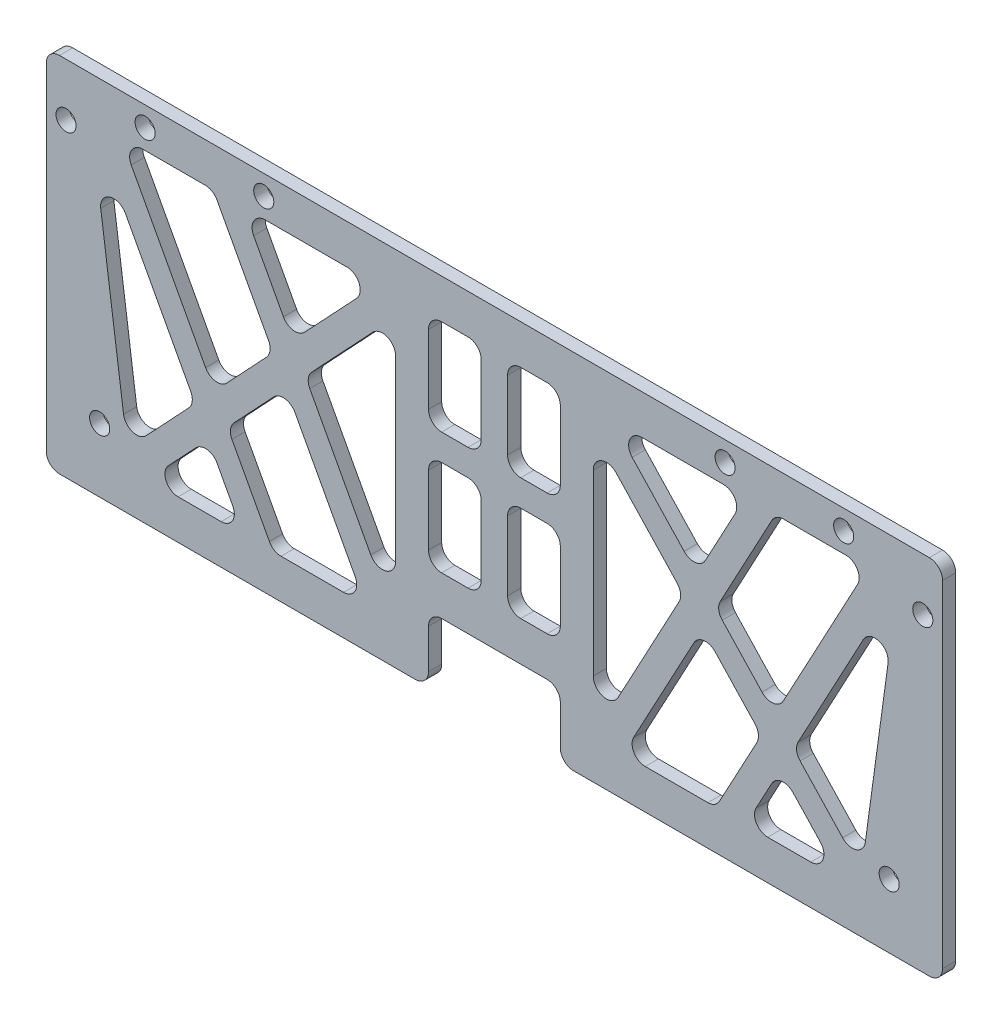
from build123d import *

# Parameters (mm, degrees)
SKETCH_1_W          = 136
SKETCH_1_H          = 55
EXTRUDE_1_DEPTH     = 2
SKETCH_2_R          = 1.525
CUT_EXTRUDE_1_DEPTH = 10
SKETCH_3_W          = 20
SKETCH_3_H          = 20
CUT_EXTRUDE_2_DEPTH = 22
FILLET_1_R          = 2
CUT_EXTRUDE_3_DEPTH = 22
EXTRUDE_2_DEPTH     = 2
SKETCH_6_W          = 8
SKETCH_6_H          = 14.5
CUT_EXTRUDE_4_DEPTH = 2
EXTRUDE_3_DEPTH     = 2
FILLET_2_R          = 2
FILLET_3_R          = 2
SKETCH_8_R          = 1.525
CUT_EXTRUDE_5_DEPTH = 10


with BuildPart() as part:
    # 草图1 → 凸台-拉伸1 (new body)
    with BuildSketch(Plane.XY):
        Rectangle(SKETCH_1_W, SKETCH_1_H)
    extrude(amount=EXTRUDE_1_DEPTH)

    # 草图2 → 切除-拉伸1 (cut)
    with BuildSketch(Plane(origin=(0, 0, 0), x_dir=(-1, 0, 0), z_dir=(0, 0, -1))):
        with Locations((59.9, -17.8)):
            Circle(SKETCH_2_R)
        with Locations((65, 19.5)):
            Circle(SKETCH_2_R)
    cut_extrude_1 = extrude(amount=-CUT_EXTRUDE_1_DEPTH, mode=Mode.SUBTRACT)

    # 镜向1: 切除-拉伸1 across plane
    add(cut_extrude_1.mirror(Plane(origin=(0, 0, 0), x_dir=(0, 0, 1), z_dir=(1, 0, 0))), mode=Mode.SUBTRACT)

    # 草图3 → 切除-拉伸2 (cut)
    with BuildSketch(Plane(origin=(0, 0, 0), x_dir=(-1, 0, 0), z_dir=(0, 0, -1))):
        with Locations((0, -27.5)):
            Rectangle(SKETCH_3_W, SKETCH_3_H)
    extrude(amount=-CUT_EXTRUDE_2_DEPTH, mode=Mode.SUBTRACT)

    # 圆角1
    fillet_1_edges = [part.edges().sort_by_distance(p)[0] for p in [
        (10, -27.5, 1),
        (10, -17.5, 1),
        (-10, -27.5, 1),
        (-10, -17.5, 1),
    ]]
    fillet(fillet_1_edges, radius=FILLET_1_R)

    # 草图4 → 切除-拉伸3 (cut)
    with BuildSketch(Plane.XY.offset(2)):
        Polygon((-61.236241819, 21.5), (-55.356885251, -21.5), (-15, -21.5), (-15, 21.5), align=None)
    cut_extrude_3 = extrude(amount=-CUT_EXTRUDE_3_DEPTH, mode=Mode.SUBTRACT)

    # 草图5 → 凸台-拉伸2 (add)
    with BuildSketch(Plane.XY.offset(2)):
        Polygon((-61.236241819, 21.5), (-38.11812091, -21.5), (-33.576673053, -21.5), (-56.694793962, 21.5), align=None)
        Polygon((-38.11812091, 21.5), (-15, -21.5), (-19.541447857, -21.5), (-42.659568766, 21.5), align=None)
    extrude_2 = extrude(amount=-EXTRUDE_2_DEPTH)

    # 镜向3: 切除-拉伸3, 凸台-拉伸2 across plane
    add(cut_extrude_3.mirror(Plane(origin=(0, 0, 0), x_dir=(0, 0, 1), z_dir=(1, 0, 0))), mode=Mode.SUBTRACT)
    add(extrude_2.mirror(Plane(origin=(0, 0, 0), x_dir=(0, 0, 1), z_dir=(1, 0, 0))))

    # 草图6 → 切除-拉伸4 (cut)
    with BuildSketch(Plane.XY.offset(2)):
        with Locations((-6, 14.25)):
            Rectangle(SKETCH_6_W, SKETCH_6_H)
        with Locations((6, 14.25)):
            Rectangle(SKETCH_6_W, SKETCH_6_H)
        with Locations((6, -4.25)):
            Rectangle(SKETCH_6_W, SKETCH_6_H)
        with Locations((-6, -4.25)):
            Rectangle(SKETCH_6_W, SKETCH_6_H)
    extrude(amount=-CUT_EXTRUDE_4_DEPTH, mode=Mode.SUBTRACT)

    # 草图7 → 凸台-拉伸3 (add)
    with BuildSketch(Plane(origin=(0, 0, 0), x_dir=(-1, 0, 0), z_dir=(0, 0, -1))):
        with BuildLine():
            Line((-16.458323102, 22.868683211), (-56.815208352, -20.131316789))
            ThreePointArc((-56.815208352, -20.131316789), (-56.725568462, -22.958323102), (-53.898562149, -22.868683211))
            Line((-53.898562149, -22.868683211), (-13.541676898, 20.131316789))
            ThreePointArc((-13.541676898, 20.131316789), (-13.631316789, 22.958323102), (-16.458323102, 22.868683211))
        make_face()
    extrude_3 = extrude(amount=-EXTRUDE_3_DEPTH)

    # 镜向4: 凸台-拉伸3 across plane
    add(extrude_3.mirror(Plane(origin=(0, 0, 0), x_dir=(0, 0, 1), z_dir=(1, 0, 0))))

    # 圆角2
    fillet_2_edges = [part.edges().sort_by_distance(p)[0] for p in [
        (-38.11812091, -21.5, 1),
        (-33.576673053, -21.5, 1),
        (-56.694793962, 21.5, 1),
        (-19.541447857, -21.5, 1),
        (-38.11812091, 21.5, 1),
        (-42.659568766, 21.5, 1),
        (61.236241819, 21.5, 1),
        (15, -21.5, 1),
        (56.694793962, 21.5, 1),
        (38.11812091, -21.5, 1),
        (33.576673053, -21.5, 1),
        (38.11812091, 21.5, 1),
        (42.659568766, 21.5, 1),
        (19.541447857, -21.5, 1),
        (-2, 3, 1),
        (-2, -11.5, 1),
        (-10, -11.5, 1),
        (-10, 3, 1),
        (2, -11.5, 1),
        (10, -11.5, 1),
        (10, 3, 1),
        (2, 3, 1),
        (2, 7, 1),
        (10, 7, 1),
        (10, 21.5, 1),
        (2, 21.5, 1),
        (-2, 7, 1),
        (-2, 21.5, 1),
        (-10, 21.5, 1),
        (-10, 7, 1),
        (30.69728876, 7.697157473, 1),
        (28.699332342, 3.980933031, 1),
        (52.614008864, -21.5, 1),
        (43.397642893, -11.680021717, 1),
        (40.510227812, -8.603499639, 1),
        (15, 18.577482964, 1),
        (55.705666805, -18.949107453, 1),
        (45.39559931, -7.963797276, 1),
        (42.50818423, -4.887275198, 1),
        (17.742876387, 21.5, 1),
        (31.586747423, 0.904410953, 1),
        (33.58470384, 4.620635395, 1),
        (-30.69728876, 7.697157473, 1),
        (-28.699332342, 3.980933031, 1),
        (-52.614008864, -21.5, 1),
        (-15, 18.577482964, 1),
        (-43.397642893, -11.680021717, 1),
        (-40.510227812, -8.603499639, 1),
        (-31.586747423, 0.904410953, 1),
        (-17.742876387, 21.5, 1),
        (-55.705666805, -18.949107453, 1),
        (-45.39559931, -7.963797276, 1),
        (-42.50818423, -4.887275198, 1),
        (-33.58470384, 4.620635395, 1),
        (-61.236241819, 21.5, 1),
        (-15, -21.5, 1),
    ]]
    fillet(fillet_2_edges, radius=FILLET_2_R)

    # 圆角3
    fillet_3_edges = [part.edges().sort_by_distance(p)[0] for p in [
        (68, -27.5, 1),
        (-68, -27.5, 1),
        (-68, 27.5, 1),
        (68, 27.5, 1),
    ]]
    fillet(fillet_3_edges, radius=FILLET_3_R)

    # 草图8 → 切除-拉伸5 (cut)
    with BuildSketch(Plane(origin=(0, 0, 0), x_dir=(-1, 0, 0), z_dir=(0, 0, -1))):
        with Locations((53, 24.5)):
            Circle(SKETCH_8_R)
        with Locations((35, 24.5)):
            Circle(SKETCH_8_R)
    cut_extrude_5 = extrude(amount=-CUT_EXTRUDE_5_DEPTH, mode=Mode.SUBTRACT)

    # 镜向5: 切除-拉伸5 across plane
    add(cut_extrude_5.mirror(Plane(origin=(0, 0, 0), x_dir=(0, 0, 1), z_dir=(1, 0, 0))), mode=Mode.SUBTRACT)


solid = part.part
